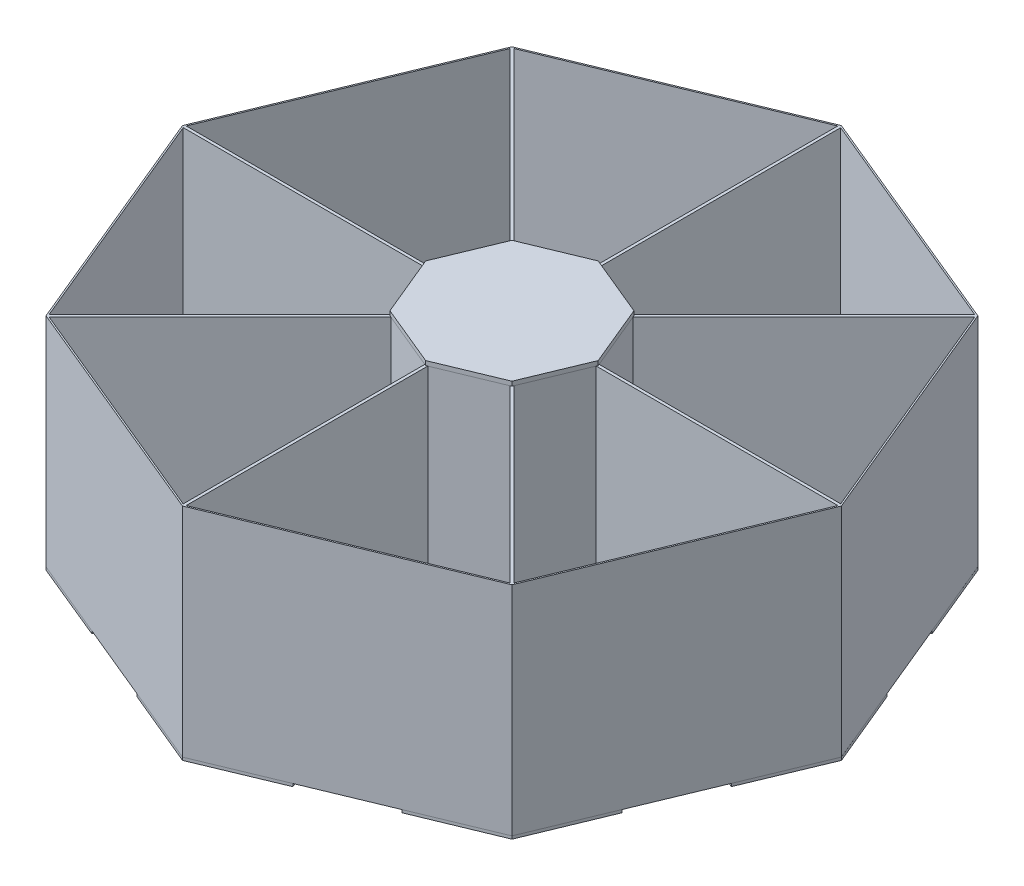
from build123d import *

# Parameters (mm, degrees)
BOSS_EXTRUDE1_DEPTH = 150
BOSS_EXTRUDE2_DEPTH = 3
BOSS_EXTRUDE3_DEPTH = 2
CIRPATTERN1_COUNT   = 8


with BuildPart() as part:
    # Sketch1 → Boss-Extrude1 (new body)
    with BuildSketch(Plane(origin=(0, 0, 0), x_dir=(1, 0, 0), z_dir=(0, 1, 0))):
        Polygon((227.244412963, 0), (160.686065393, 160.686065393), (0, 227.244412963), (-160.686065393, 160.686065393), (-227.244412963, 0), (-160.686065393, -160.686065393), (0, -227.244412963), (160.686065393, -160.686065393), align=None)
        Polygon((-158.959000036, -160.319047086), (-41.038336356, -42.398383406), (-1, -58.982805339), (-1, -225.7478072), align=None, mode=Mode.SUBTRACT)
        Polygon((-225.770243704, -0.945833488), (-59.036971851, -0.945833488), (-42.452549918, -40.984169844), (-160.350777095, -158.88239702), align=None, mode=Mode.SUBTRACT)
        Polygon((1, -225.7478072), (1, -58.982805339), (41.038336356, -42.398383406), (158.959000036, -160.319047086), align=None, mode=Mode.SUBTRACT)
        Polygon((160.350777095, -158.88239702), (42.452549918, -40.984169844), (59.036971851, -0.945833488), (225.770243704, -0.945833488), align=None, mode=Mode.SUBTRACT)
        Polygon((-160.319047086, 158.959000036), (-42.452549918, 41.092502868), (-59.036971851, 1.054166512), (-225.725370696, 1.054166512), align=None, mode=Mode.SUBTRACT)
        Polygon((-41.272969491, 41.327136003), (0, 58.422959726), (41.272969491, 41.327136003), (58.368793213, 0.054166512), (41.272969491, -41.218802979), (0, -58.314626701), (-41.272969491, -41.218802979), (-58.368793213, 0.054166512), align=None, mode=Mode.SUBTRACT)
        Polygon((-1, 225.7478072), (-1, 59.091138364), (-41.038336356, 42.50671643), (-158.88239702, 160.350777095), align=None, mode=Mode.SUBTRACT)
        Polygon((225.725370696, 1.054166512), (59.036971851, 1.054166512), (42.452549918, 41.092502868), (160.319047086, 158.959000036), align=None, mode=Mode.SUBTRACT)
        Polygon((158.88239702, 160.350777095), (41.038336356, 42.50671643), (1, 59.091138364), (1, 225.7478072), align=None, mode=Mode.SUBTRACT)
    extrude(amount=BOSS_EXTRUDE1_DEPTH)

    # Sketch2 → Boss-Extrude2 (add)
    with BuildSketch(Plane(origin=(0, 150, 0), x_dir=(1, 0, 0), z_dir=(0, 1, 0))):
        Polygon((0, 59.505351926), (-42.076637864, 42.076637864), (-59.505351926, 0), (-42.076637864, -42.076637864), (0, -59.505351926), (42.076637864, -42.076637864), (59.505351926, 0), (42.076637864, 42.076637864), align=None)
    extrude(amount=BOSS_EXTRUDE2_DEPTH)

    # Sketch4 → Boss-Extrude3 (add)
    with BuildSketch(Plane.XZ):
        Polygon((-43.23156875, 39.141387058), (-178.796553997, 100.662504749), (-177.049364724, 104.512527258), (-182.861362419, 106.909146045), (-160.686065393, 160.686065393), (-42.019552833, 42.019552833), align=None)
        Polygon((-58.246475638, 2.892195211), (-197.607395503, 55.249116065), (-199.094323145, 51.291289658), (-204.898691523, 53.706327244), (-227.244412963, 0), (-59.424621501, 0), align=None)
    boss_extrude3 = extrude(amount=BOSS_EXTRUDE3_DEPTH)

    # CirPattern1: Boss-Extrude3 ×8 about axis
    cirpattern1_axis = Axis((0, 0, -0.054166512), (0, 1, 0))
    for i in range(1, CIRPATTERN1_COUNT):
        add(boss_extrude3.rotate(cirpattern1_axis, i * 360 / CIRPATTERN1_COUNT))


solid = part.part
